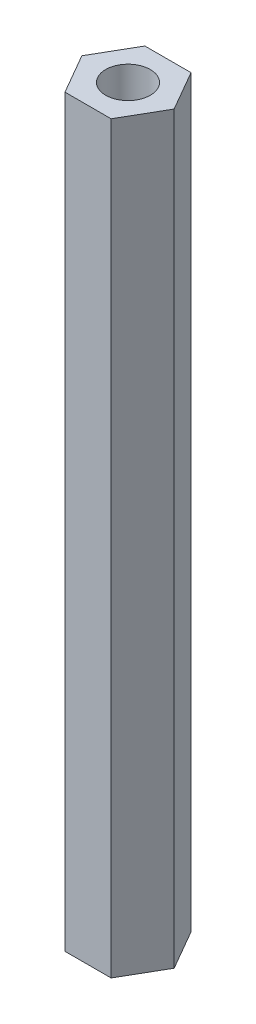
from build123d import *

# Parameters (mm, degrees)
SALIENTE_EXTRUIR1_DEPTH = 50
CROQUIS2_R              = 1.5
CORTAR_EXTRUIR1_DEPTH   = 10
CORTAR_EXTRUIR2_START   = -10
CROQUIS3_R              = 1.5
CORTAR_EXTRUIR2_DEPTH   = 10


with BuildPart() as part:
    # Croquis1 → Saliente-Extruir1 (new body)
    with BuildSketch(Plane(origin=(0, 0, 0), x_dir=(1, 0, 0), z_dir=(0, 1, 0))):
        Polygon((3.1, 0), (1.55, 2.684678752), (-1.55, 2.684678752), (-3.1, 0), (-1.55, -2.684678752), (1.55, -2.684678752), align=None)
    extrude(amount=SALIENTE_EXTRUIR1_DEPTH)

    # Croquis2 → Cortar-Extruir1 (cut)
    with BuildSketch(Plane(origin=(0, 50, 0), x_dir=(1, 0, 0), z_dir=(0, 1, 0))):
        with Locations(Location((0, 0, 0), (0, 0, 270))):
            Circle(CROQUIS2_R)
    extrude(amount=-CORTAR_EXTRUIR1_DEPTH, mode=Mode.SUBTRACT)

    # Croquis3 → Cortar-Extruir2 (cut)
    with BuildSketch(Plane.XZ.offset(CORTAR_EXTRUIR2_START)):
        with Locations(Location((0, 0, 0), (0, 0, 90))):
            Circle(CROQUIS3_R)
    extrude(amount=CORTAR_EXTRUIR2_DEPTH, mode=Mode.SUBTRACT)


solid = part.part
